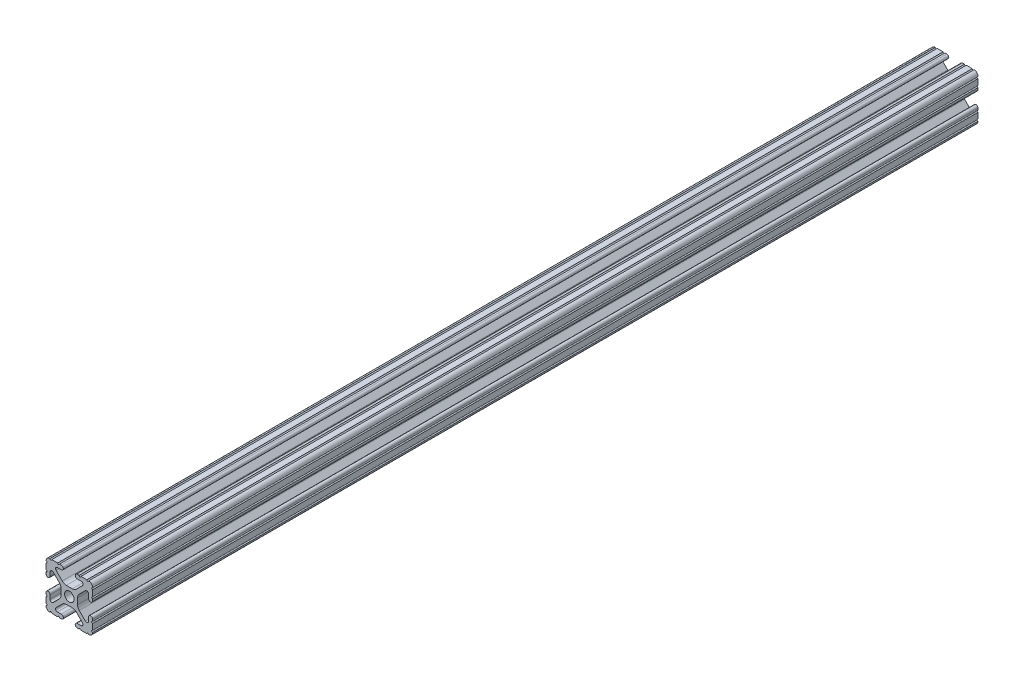
from build123d import *

# Parameters (mm, degrees)
SKETCH1_R           = 2.6035
BOSS_EXTRUDE1_DEPTH = 482.6


with BuildPart() as part:
    # Sketch1 → Boss-Extrude1 (new body)
    with BuildSketch(Plane(origin=(0, 0, -25.4), x_dir=(-1, 0, 0), z_dir=(0, 0, -1))):
        with BuildLine():
            Line((12.7, -9.5504), (12.7, -6.3330836))
            ThreePointArc((12.7, -6.3330836), (12.192, -5.8250836), (12.7, -5.3170836))
            Line((12.7, -5.3170836), (12.7, -4.3434))
            ThreePointArc((12.7, -4.3434), (11.5951, -3.2385), (10.4902, -4.3434))
            Line((10.4902, -4.3434), (10.4902, -6.474794456))
            ThreePointArc((10.4902, -6.474794456), (9.863006367, -7.413456061), (8.75577951, -7.193214945))
            Line((8.75577951, -7.193214945), (5.42573597, -3.863171405))
            ThreePointArc((5.42573597, -3.863171405), (4.737482484, -2.833127272), (4.4958, -1.618107374))
            Line((4.4958, -1.618107374), (4.4958, 1.618107374))
            ThreePointArc((4.4958, 1.618107374), (4.737482484, 2.833127272), (5.42573597, 3.863171405))
            Line((5.42573597, 3.863171405), (8.75577951, 7.193214945))
            ThreePointArc((8.75577951, 7.193214945), (9.863006367, 7.413456061), (10.4902, 6.474794456))
            Line((10.4902, 6.474794456), (10.4902, 4.343399971))
            ThreePointArc((10.4902, 4.343399971), (11.5951, 3.238499971), (12.7, 4.343399971))
            Line((12.7, 4.343399971), (12.7, 5.3170836))
            ThreePointArc((12.7, 5.3170836), (12.192, 5.8250836), (12.7, 6.3330836))
            Line((12.7, 6.3330836), (12.7, 9.5504))
            ThreePointArc((12.7, 9.5504), (12.192000006, 10.058323491), (12.699846982, 10.566399977))
            ThreePointArc((12.699846982, 10.566399977), (12.082522516, 12.082522516), (10.566399977, 12.699846982))
            ThreePointArc((10.566399977, 12.699846982), (10.058323491, 12.192000006), (9.5504, 12.7))
            Line((9.5504, 12.7), (6.3330836, 12.7))
            ThreePointArc((6.3330836, 12.7), (5.8250836, 12.192), (5.3170836, 12.7))
            Line((5.3170836, 12.7), (4.3434, 12.7))
            ThreePointArc((4.3434, 12.7), (3.2385, 11.5951), (4.3434, 10.4902))
            Line((4.3434, 10.4902), (6.474794456, 10.4902))
            ThreePointArc((6.474794456, 10.4902), (7.413456061, 9.863006367), (7.193214945, 8.75577951))
            Line((7.193214945, 8.75577951), (3.863171405, 5.42573597))
            ThreePointArc((3.863171405, 5.42573597), (2.833127272, 4.737482484), (1.618107374, 4.4958))
            Line((1.618107374, 4.4958), (-1.618107374, 4.4958))
            ThreePointArc((-1.618107374, 4.4958), (-2.833127272, 4.737482484), (-3.863171405, 5.42573597))
            Line((-3.863171405, 5.42573597), (-7.193214945, 8.75577951))
            ThreePointArc((-7.193214945, 8.75577951), (-7.413456061, 9.863006367), (-6.474794456, 10.4902))
            Line((-6.474794456, 10.4902), (-4.343399971, 10.4902))
            ThreePointArc((-4.343399971, 10.4902), (-3.238499971, 11.5951), (-4.343399971, 12.7))
            Line((-4.343399971, 12.7), (-5.3170836, 12.7))
            ThreePointArc((-5.3170836, 12.7), (-5.8250836, 12.192), (-6.3330836, 12.7))
            Line((-6.3330836, 12.7), (-9.5504, 12.7))
            ThreePointArc((-9.5504, 12.7), (-10.058323491, 12.192000006), (-10.566399977, 12.699846982))
            ThreePointArc((-10.566399977, 12.699846982), (-12.082522516, 12.082522516), (-12.699846982, 10.566399977))
            ThreePointArc((-12.699846982, 10.566399977), (-12.192000006, 10.058323491), (-12.7, 9.5504))
            Line((-12.7, 9.5504), (-12.7, 6.3330836))
            ThreePointArc((-12.7, 6.3330836), (-12.192, 5.8250836), (-12.7, 5.3170836))
            Line((-12.7, 5.3170836), (-12.7, 4.3434))
            ThreePointArc((-12.7, 4.3434), (-11.5951, 3.2385), (-10.4902, 4.3434))
            Line((-10.4902, 4.3434), (-10.4902, 6.474794456))
            ThreePointArc((-10.4902, 6.474794456), (-9.863006367, 7.413456061), (-8.75577951, 7.193214945))
            Line((-8.75577951, 7.193214945), (-5.42573597, 3.863171405))
            ThreePointArc((-5.42573597, 3.863171405), (-4.737482484, 2.833127272), (-4.4958, 1.618107374))
            Line((-4.4958, 1.618107374), (-4.4958, -1.618107374))
            ThreePointArc((-4.4958, -1.618107374), (-4.737482484, -2.833127272), (-5.42573597, -3.863171405))
            Line((-5.42573597, -3.863171405), (-8.75577951, -7.193214945))
            ThreePointArc((-8.75577951, -7.193214945), (-9.863006367, -7.413456061), (-10.4902, -6.474794456))
            Line((-10.4902, -6.474794456), (-10.4902, -4.343399971))
            ThreePointArc((-10.4902, -4.343399971), (-11.5951, -3.238499971), (-12.7, -4.343399971))
            Line((-12.7, -4.343399971), (-12.7, -5.3170836))
            ThreePointArc((-12.7, -5.3170836), (-12.192, -5.8250836), (-12.7, -6.3330836))
            Line((-12.7, -6.3330836), (-12.7, -9.5504))
            ThreePointArc((-12.7, -9.5504), (-12.192000006, -10.058323491), (-12.699846982, -10.566399977))
            ThreePointArc((-12.699846982, -10.566399977), (-12.082522516, -12.082522516), (-10.566399977, -12.699846982))
            ThreePointArc((-10.566399977, -12.699846982), (-10.058323491, -12.192000006), (-9.5504, -12.7))
            Line((-9.5504, -12.7), (-6.3330836, -12.7))
            ThreePointArc((-6.3330836, -12.7), (-5.8250836, -12.192), (-5.3170836, -12.7))
            Line((-5.3170836, -12.7), (-4.3434, -12.7))
            ThreePointArc((-4.3434, -12.7), (-3.2385, -11.5951), (-4.3434, -10.4902))
            Line((-4.3434, -10.4902), (-6.474794456, -10.4902))
            ThreePointArc((-6.474794456, -10.4902), (-7.413456061, -9.863006367), (-7.193214945, -8.75577951))
            Line((-7.193214945, -8.75577951), (-3.863171405, -5.42573597))
            ThreePointArc((-3.863171405, -5.42573597), (-2.833127272, -4.737482484), (-1.618107374, -4.4958))
            Line((-1.618107374, -4.4958), (1.618107374, -4.4958))
            ThreePointArc((1.618107374, -4.4958), (2.833127272, -4.737482484), (3.863171405, -5.42573597))
            Line((3.863171405, -5.42573597), (7.193214945, -8.75577951))
            ThreePointArc((7.193214945, -8.75577951), (7.413456061, -9.863006367), (6.474794456, -10.4902))
            Line((6.474794456, -10.4902), (4.343399971, -10.4902))
            ThreePointArc((4.343399971, -10.4902), (3.238499971, -11.5951), (4.343399971, -12.7))
            Line((4.343399971, -12.7), (5.3170836, -12.7))
            ThreePointArc((5.3170836, -12.7), (5.8250836, -12.192), (6.3330836, -12.7))
            Line((6.3330836, -12.7), (9.5504, -12.7))
            ThreePointArc((9.5504, -12.7), (10.058323491, -12.192000006), (10.566399977, -12.699846982))
            ThreePointArc((10.566399977, -12.699846982), (12.082522516, -12.082522516), (12.699846982, -10.566399977))
            ThreePointArc((12.699846982, -10.566399977), (12.192000006, -10.058323491), (12.7, -9.5504))
        make_face()
        Circle(SKETCH1_R, mode=Mode.SUBTRACT)
    extrude(amount=-BOSS_EXTRUDE1_DEPTH)


solid = part.part
